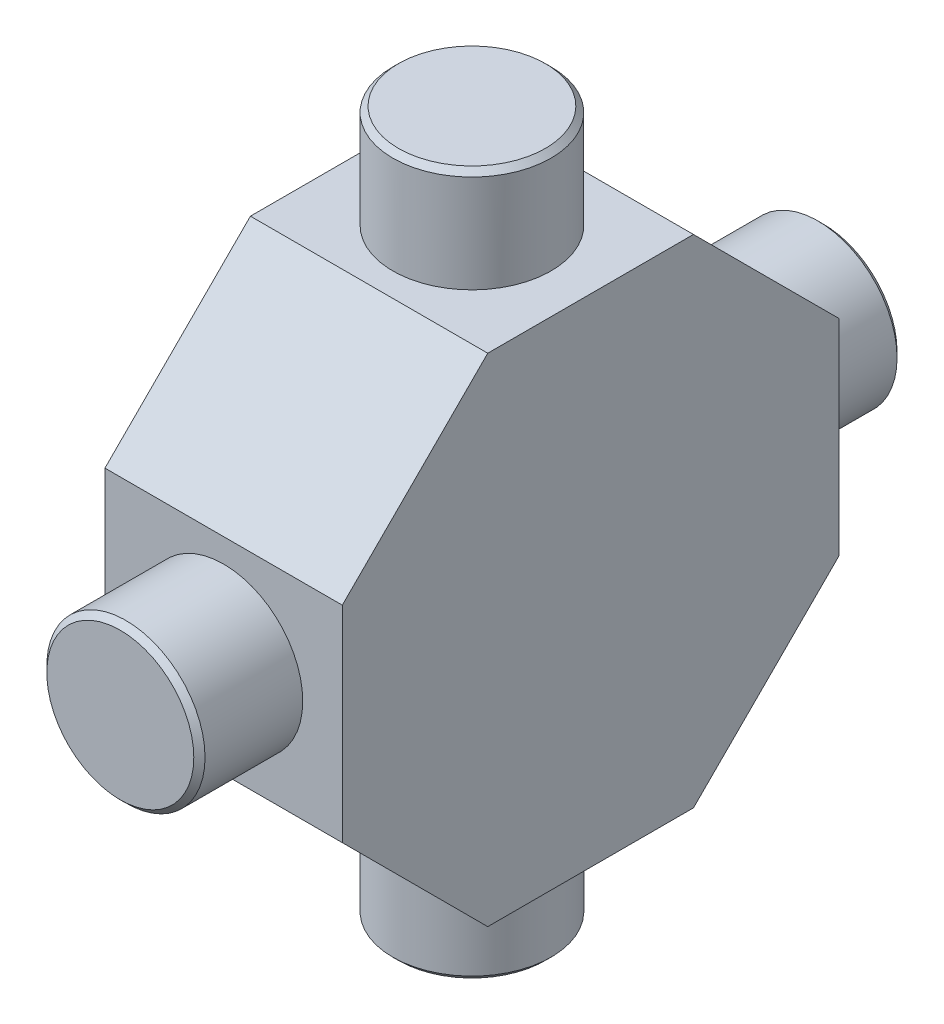
from build123d import *

# Parameters (mm, degrees)
EXTRUDE10_DEPTH          = 31.75
EXTRUDE10_DEPTH_BACK     = 31.75
SKETCH10_R               = 7.14375
BOSS_EXTRUDE7_DEPTH      = 31.75
BOSS_EXTRUDE7_DEPTH_BACK = 31.75
SKETCH31_R               = 7.14375
BOSS_EXTRUDE8_DEPTH      = 10.715625
CHAMFER2_SIZE            = 0.508


with BuildPart() as part:
    # Sketch10 → Extrude10 (new, two sides: drawn at the far end of the back side and taken through both)
    with BuildSketch(Plane.XY.offset(-EXTRUDE10_DEPTH_BACK)):
        Circle(SKETCH10_R)
    extrude(amount=EXTRUDE10_DEPTH + EXTRUDE10_DEPTH_BACK)



with BuildPart() as body_2:
    # Sketch31 → Boss-Extrude7 (new, two sides: drawn at the far end of the back side and taken through both)
    with BuildSketch(Plane(origin=(0, 0, 0), x_dir=(1, 0, 0), z_dir=(0, 1, 0)).offset(-BOSS_EXTRUDE7_DEPTH_BACK)):
        Circle(SKETCH31_R)
    extrude(amount=BOSS_EXTRUDE7_DEPTH + BOSS_EXTRUDE7_DEPTH_BACK)


with BuildPart() as part_1:
    add(part.part)

    add(body_2.part)  # Boss-Extrude8 merges body 2
    # Sketch32 → Boss-Extrude8 (add, symmetric)
    with BuildSketch(Plane(origin=(0, 0, 0), x_dir=(0, 0, -1), z_dir=(1, 0, 0))):
        Polygon((9.286875, -22.420499577), (22.420499577, -9.286875), (22.420499577, 9.286875), (9.286875, 22.420499577), (-9.286875, 22.420499577), (-22.420499577, 9.286875), (-22.420499577, -9.286875), (-9.286875, -22.420499577), align=None)
    extrude(amount=BOSS_EXTRUDE8_DEPTH, both=True)

    # Chamfer2
    chamfer2_edges = [part_1.edges().sort_by_distance(p)[0] for p in [
        (-7.14375, -31.75, 0),
        (-7.14375, 0, -31.75),
        (-7.14375, 31.75, 0),
        (-7.14375, 0, 31.75),
    ]]
    chamfer(chamfer2_edges, length=CHAMFER2_SIZE)


solid = part_1.part
